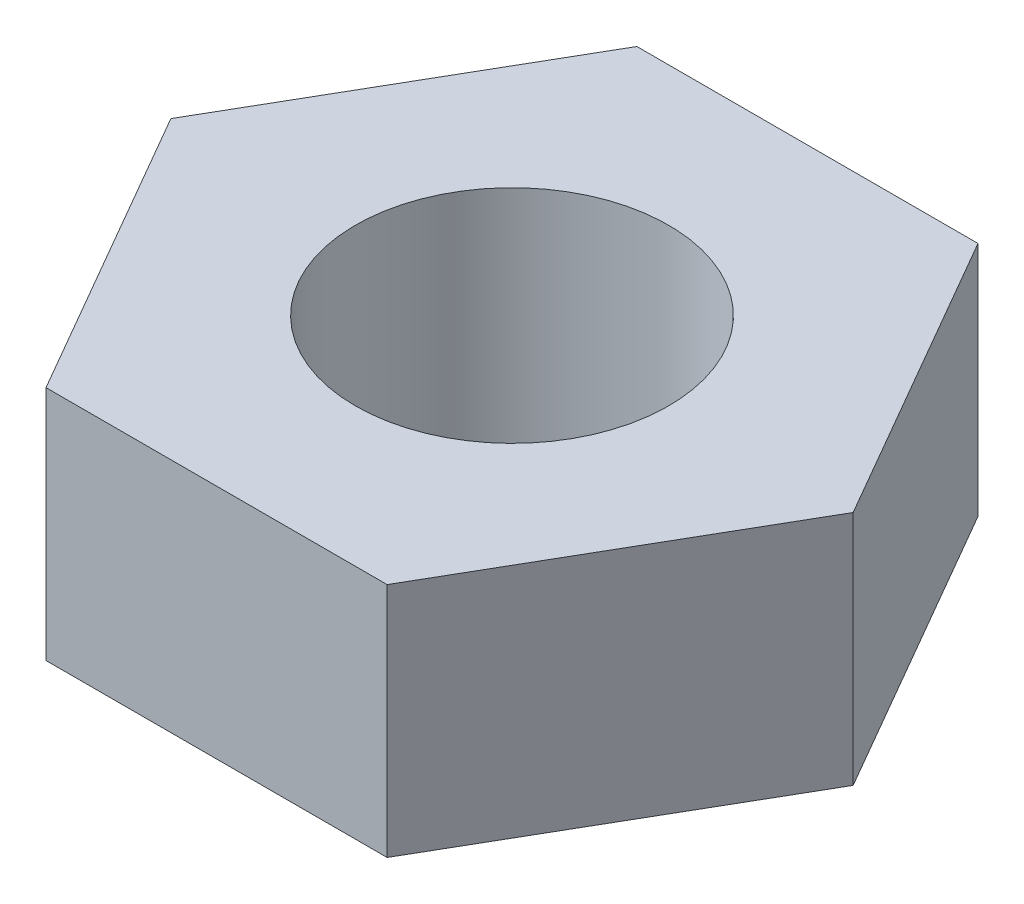
from build123d import *

# Parameters (mm, degrees)
SKETCH1_R           = 2.65
BOSS_EXTRUDE1_DEPTH = 4


with BuildPart() as part:
    # Sketch1 → Boss-Extrude1 (new body)
    with BuildSketch(Plane(origin=(0, 0, 0), x_dir=(1, 0, 0), z_dir=(0, 1, 0))):
        Polygon((2.886751346, 5), (-2.886751346, 5), (-5.773502692, 0), (-2.886751346, -5), (2.886751346, -5), (5.773502692, 0), align=None)
        with Locations(Location((0, 0, 0), (0, 0, 270))):
            Circle(SKETCH1_R, mode=Mode.SUBTRACT)
    extrude(amount=BOSS_EXTRUDE1_DEPTH)


solid = part.part
